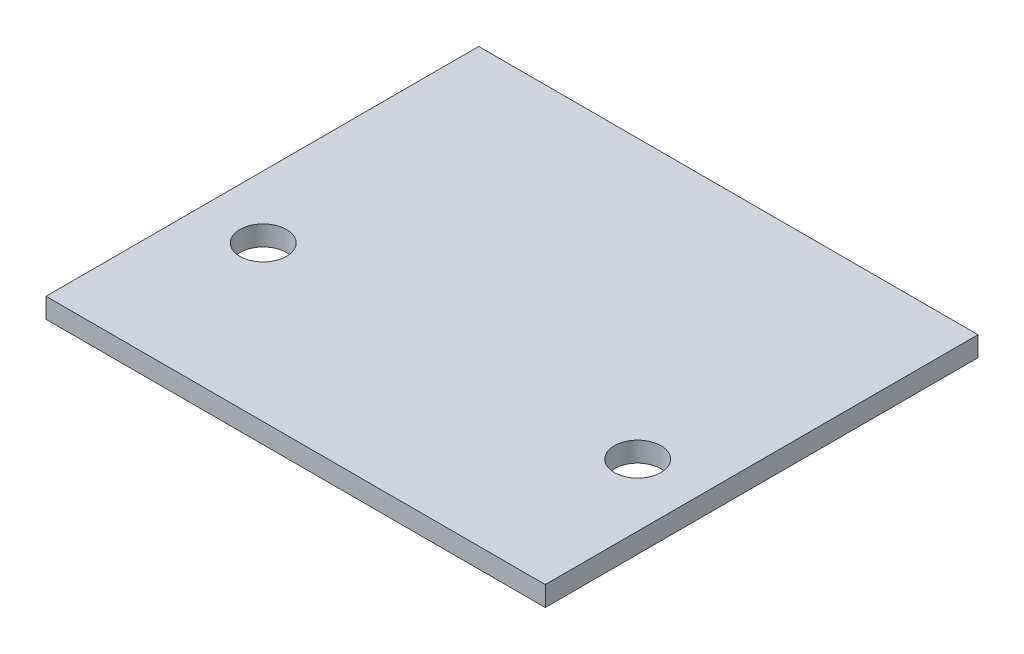
from build123d import *

# Parameters (mm, degrees)
SKETCH_1_W      = 30
SKETCH_1_H      = 26
SKETCH_1_R      = 1.4
EXTRUDE_1_DEPTH = 1.2


with BuildPart() as part:
    # 草图1 → 凸台-拉伸1 (new body)
    with BuildSketch(Plane(origin=(0, 0, 0), x_dir=(1, 0, 0), z_dir=(0, 1, 0))):
        Rectangle(SKETCH_1_W, SKETCH_1_H)
        with Locations(Location((-11.25, -3.7, 0), (0, 0, 270))):
            Circle(SKETCH_1_R, mode=Mode.SUBTRACT)
        with Locations(Location((11.25, -3.7, 0), (0, 0, 90))):
            Circle(SKETCH_1_R, mode=Mode.SUBTRACT)
    extrude(amount=EXTRUDE_1_DEPTH)


solid = part.part
